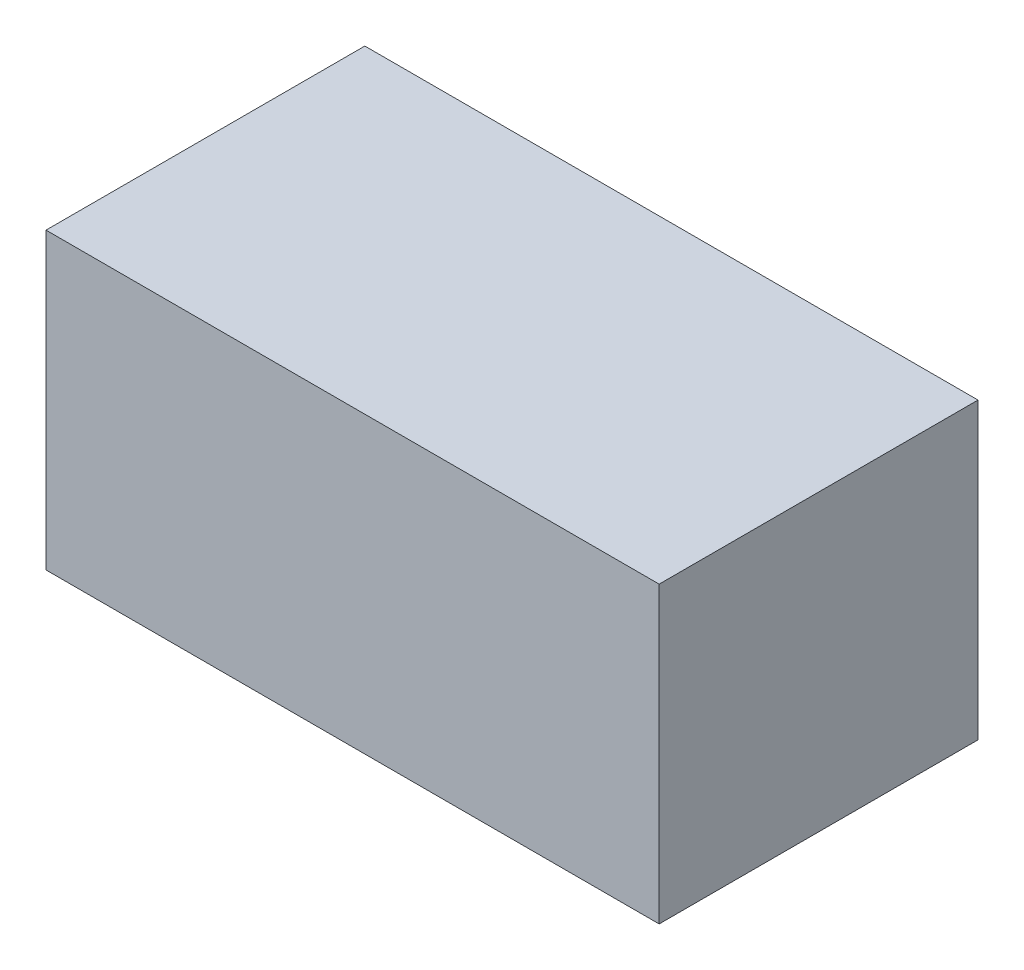
from build123d import *

# Parameters (mm, degrees)
SKETCH1_W           = 125
SKETCH1_H           = 65
BOSS_EXTRUDE1_DEPTH = 60


with BuildPart() as part:
    # Sketch1 → Boss-Extrude1 (new body)
    with BuildSketch(Plane(origin=(0, 0, 0), x_dir=(1, 0, 0), z_dir=(0, 1, 0))):
        Rectangle(SKETCH1_W, SKETCH1_H)
    extrude(amount=BOSS_EXTRUDE1_DEPTH)


solid = part.part
